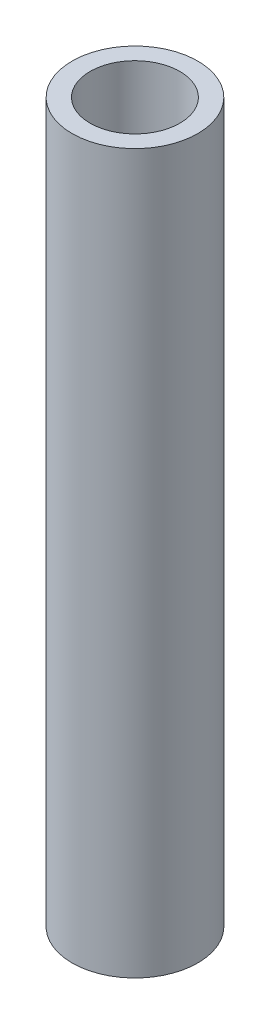
from build123d import *

# Parameters (mm, degrees)
SKETCH1_R           = 7
BOSS_EXTRUDE1_DEPTH = 80
SKETCH2_R           = 5
CUT_EXTRUDE1_DEPTH  = 20


with BuildPart() as part:
    # Sketch1 → Boss-Extrude1 (new body)
    with BuildSketch(Plane(origin=(0, 0, 0), x_dir=(1, 0, 0), z_dir=(0, 1, 0))):
        with Locations(Location((0, 0, 0), (0, 0, 270))):
            Circle(SKETCH1_R)
    extrude(amount=BOSS_EXTRUDE1_DEPTH)

    # Sketch2 → Cut-Extrude1 (cut)
    with BuildSketch(Plane(origin=(0, 80, 0), x_dir=(1, 0, 0), z_dir=(0, 1, 0))):
        with Locations(Location((0, 0, 0), (0, 0, 270))):
            Circle(SKETCH2_R)
    extrude(amount=-CUT_EXTRUDE1_DEPTH, mode=Mode.SUBTRACT)


solid = part.part
